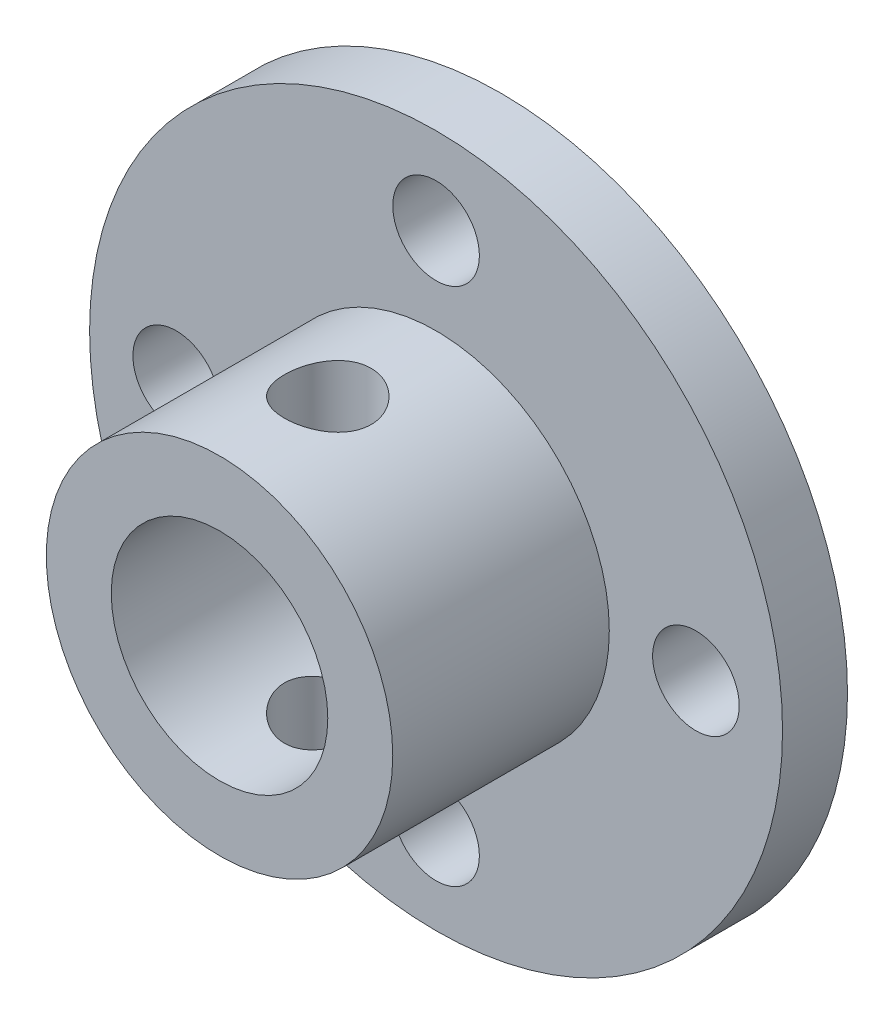
from build123d import *

# Parameters (mm, degrees)
SKETCH_1_R               = 16
EXTRUDE_1_DEPTH          = 3
SKETCH_2_R               = 8
EXTRUDE_2_DEPTH          = 10
SKETCH_3_R               = 5
CUT_EXTRUDE_1_DEPTH      = 27.095976701
SKETCH_4_R               = 2
CUT_EXTRUDE_2_DEPTH      = 25.738633754
CUT_EXTRUDE_3_DEPTH      = 27.095976701
CUT_EXTRUDE_3_DEPTH_BACK = 27.095976701
SKETCH_5_R               = 2


with BuildPart() as part:
    # 草图1 → 凸台-拉伸1 (new body)
    with BuildSketch(Plane.XY):
        Circle(SKETCH_1_R)
    extrude(amount=EXTRUDE_1_DEPTH)

    # 草图2 → 凸台-拉伸2 (add)
    with BuildSketch(Plane.XY.offset(3)):
        Circle(SKETCH_2_R)
    extrude(amount=EXTRUDE_2_DEPTH)

    # 草图3 → 切除-拉伸1 (cut, through all)
    with BuildSketch(Plane.XY.offset(13)):
        Circle(SKETCH_3_R)
    extrude(amount=-CUT_EXTRUDE_1_DEPTH, mode=Mode.SUBTRACT)

    # 草图4 → 切除-拉伸2 (cut, through all)
    with BuildSketch(Plane.XY.offset(3)):
        with Locations((0, 12)):
            Circle(SKETCH_4_R)
        with Locations((12, 0)):
            Circle(SKETCH_4_R)
        with Locations((0, -12)):
            Circle(SKETCH_4_R)
        with Locations((-12, 0)):
            Circle(SKETCH_4_R)
    extrude(amount=-CUT_EXTRUDE_2_DEPTH, mode=Mode.SUBTRACT)

    # 草图5 → 切除-拉伸3 (cut, two sides: drawn at the far end of the back side and taken through both)
    with BuildSketch(Plane(origin=(0, 0, 0), x_dir=(1, 0, 0), z_dir=(0, 1, 0)).offset(-CUT_EXTRUDE_3_DEPTH_BACK)):
        with Locations(Location((0, -8, 0), (0, 0, 270))):
            Circle(SKETCH_5_R)
    extrude(amount=CUT_EXTRUDE_3_DEPTH + CUT_EXTRUDE_3_DEPTH_BACK, mode=Mode.SUBTRACT)


solid = part.part
